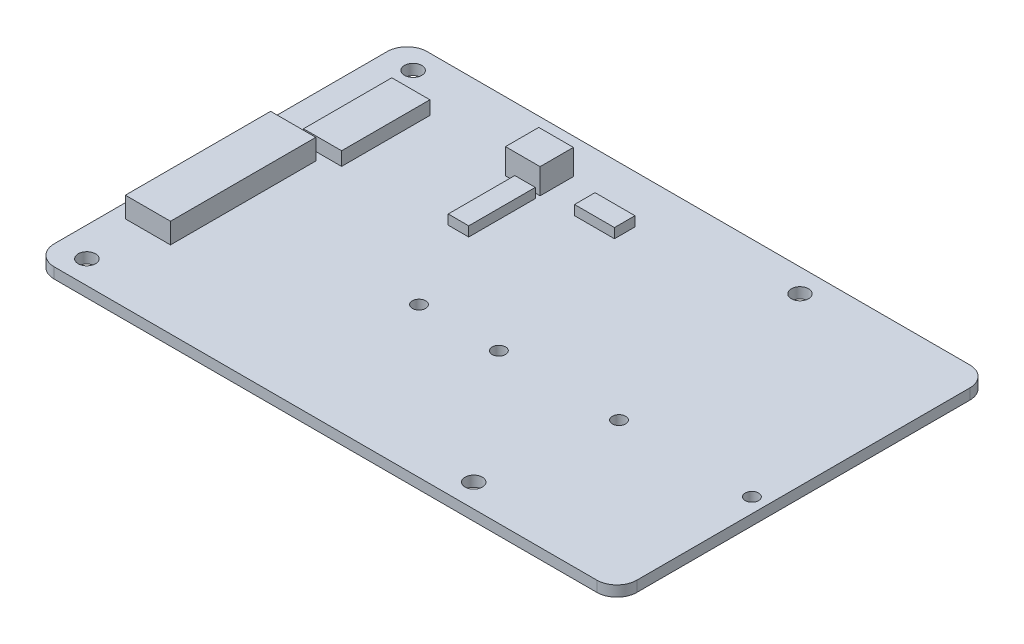
from build123d import *

# Parameters (mm, degrees)
SKETCH1_R                    = 1.3
PCB_DEPTH                    = 1.6
NVME_M_KEY_SCREW_HOLES_REACH = 946.451
SKETCH2_R                    = 1
SKETCH3_W                    = 6.78
SKETCH3_H                    = 21.82
NVME_M_KEY_CONNECTOR_DEPTH   = 3.08
SKETCH4_W                    = 5.72
SKETCH4_H                    = 13.26
PCI_E_CONNECTOR_DEPTH        = 2.04
SKETCH5_W                    = 5.2
SKETCH5_H                    = 5
INDUCTANCE_DEPTH             = 3.8
SKETCH6_W                    = 3.08
SKETCH6_H                    = 10
SKETCH6_W_2                  = 6
SKETCH6_H_2                  = 3.08
CAPACITORS_DEPTH             = 1.46


with BuildPart() as part:
    # Sketch1 → pcb (new body)
    with BuildSketch(Plane(origin=(0, 0, 0), x_dir=(1, 0, 0), z_dir=(0, 1, 0))):
        with BuildLine():
            Line((-870.635383482, 358.81294964), (-789.135383482, 358.81294964))
            ThreePointArc((-789.135383482, 358.81294964), (-787.014063138, 357.934269984), (-786.135383482, 355.81294964))
            Line((-786.135383482, 355.81294964), (-786.135383482, 305.81294964))
            ThreePointArc((-786.135383482, 305.81294964), (-787.014063138, 303.691629297), (-789.135383482, 302.81294964))
            Line((-789.135383482, 302.81294964), (-870.635383482, 302.81294964))
            ThreePointArc((-870.635383482, 302.81294964), (-872.756703825, 303.691629297), (-873.635383482, 305.81294964))
            Line((-873.635383482, 305.81294964), (-873.635383482, 355.81294964))
            ThreePointArc((-873.635383482, 355.81294964), (-872.756703825, 357.934269984), (-870.635383482, 358.81294964))
        make_face()
        with Locations(Location((-869.235383482, 355.31294964, 0), (0, 0, 270))):
            Circle(SKETCH1_R, mode=Mode.SUBTRACT)
        with Locations(Location((-869.235383482, 306.31294964, 0), (0, 0, 270))):
            Circle(SKETCH1_R, mode=Mode.SUBTRACT)
        with Locations(Location((-811.135383482, 355.31294964, 0), (0, 0, 270))):
            Circle(SKETCH1_R, mode=Mode.SUBTRACT)
        with Locations(Location((-811.135383482, 306.31294964, 0), (0, 0, 270))):
            Circle(SKETCH1_R, mode=Mode.SUBTRACT)
    extrude(amount=PCB_DEPTH)

    # Sketch2 → NVMe-M-Key screw holes (cut, up to next)
    with BuildSketch(Plane(origin=(0, 1.6, 0), x_dir=(1, 0, 0), z_dir=(0, 1, 0)), mode=Mode.PRIVATE) as nvme_m_key_screw_holes_sk1:
        with Locations(Location((-788.335383482, 325.29294964, 0), (0, 0, 270))):
            Circle(SKETCH2_R)
    nvme_m_key_screw_holes_tool1 = extrude(nvme_m_key_screw_holes_sk1.sketch, amount=-NVME_M_KEY_SCREW_HOLES_REACH, mode=Mode.PRIVATE) & part.part
    # Sketch2 → NVMe-M-Key screw holes (cut, up to next)
    with BuildSketch(Plane(origin=(0, 1.6, 0), x_dir=(1, 0, 0), z_dir=(0, 1, 0)), mode=Mode.PRIVATE) as nvme_m_key_screw_holes_sk2:
        with Locations(Location((-808.295383482, 325.29294964, 0), (0, 0, 270))):
            Circle(SKETCH2_R)
    nvme_m_key_screw_holes_tool2 = extrude(nvme_m_key_screw_holes_sk2.sketch, amount=-NVME_M_KEY_SCREW_HOLES_REACH, mode=Mode.PRIVATE) & part.part
    # Sketch2 → NVMe-M-Key screw holes (cut, up to next)
    with BuildSketch(Plane(origin=(0, 1.6, 0), x_dir=(1, 0, 0), z_dir=(0, 1, 0)), mode=Mode.PRIVATE) as nvme_m_key_screw_holes_sk3:
        with Locations(Location((-826.335383482, 325.29294964, 0), (0, 0, 270))):
            Circle(SKETCH2_R)
    nvme_m_key_screw_holes_tool3 = extrude(nvme_m_key_screw_holes_sk3.sketch, amount=-NVME_M_KEY_SCREW_HOLES_REACH, mode=Mode.PRIVATE) & part.part
    # Sketch2 → NVMe-M-Key screw holes (cut, up to next)
    with BuildSketch(Plane(origin=(0, 1.6, 0), x_dir=(1, 0, 0), z_dir=(0, 1, 0)), mode=Mode.PRIVATE) as nvme_m_key_screw_holes_sk4:
        with Locations(Location((-838.335383482, 325.29294964, 0), (0, 0, 270))):
            Circle(SKETCH2_R)
    nvme_m_key_screw_holes_tool4 = extrude(nvme_m_key_screw_holes_sk4.sketch, amount=-NVME_M_KEY_SCREW_HOLES_REACH, mode=Mode.PRIVATE) & part.part
    add(nvme_m_key_screw_holes_tool1.solids().sort_by_distance((-788.335383, 1.6, -325.29295))[0], mode=Mode.SUBTRACT)
    add(nvme_m_key_screw_holes_tool2.solids().sort_by_distance((-808.295383, 1.6, -325.29295))[0], mode=Mode.SUBTRACT)
    add(nvme_m_key_screw_holes_tool3.solids().sort_by_distance((-826.335383, 1.6, -325.29295))[0], mode=Mode.SUBTRACT)
    add(nvme_m_key_screw_holes_tool4.solids().sort_by_distance((-838.335383, 1.6, -325.29295))[0], mode=Mode.SUBTRACT)

    # Sketch3 → NVMe-M-Key connector (add)
    with BuildSketch(Plane(origin=(0, 1.6, 0), x_dir=(1, 0, 0), z_dir=(0, 1, 0))):
        with Locations((-868.145383482, 325.30294964)):
            Rectangle(SKETCH3_W, SKETCH3_H)
    extrude(amount=NVME_M_KEY_CONNECTOR_DEPTH)

    # Sketch4 → PCI-E connector (add)
    with BuildSketch(Plane(origin=(0, 1.6, 0), x_dir=(1, 0, 0), z_dir=(0, 1, 0))):
        with Locations((-864.975383482, 344.081798362)):
            Rectangle(SKETCH4_W, SKETCH4_H)
    extrude(amount=PCI_E_CONNECTOR_DEPTH)

    # Sketch5 → Inductance (add)
    with BuildSketch(Plane(origin=(0, 1.6, 0), x_dir=(1, 0, 0), z_dir=(0, 1, 0))):
        with Locations((-845.985383482, 351.03294964)):
            Rectangle(SKETCH5_W, SKETCH5_H)
    extrude(amount=INDUCTANCE_DEPTH)

    # Sketch6 → Capacitors (add)
    with BuildSketch(Plane(origin=(0, 1.6, 0), x_dir=(1, 0, 0), z_dir=(0, 1, 0))):
        with Locations((-844.925383482, 342.81294964)):
            Rectangle(SKETCH6_W, SKETCH6_H)
        with Locations((-835.215383482, 350.07294964)):
            Rectangle(SKETCH6_W_2, SKETCH6_H_2)
    extrude(amount=CAPACITORS_DEPTH)


solid = part.part
